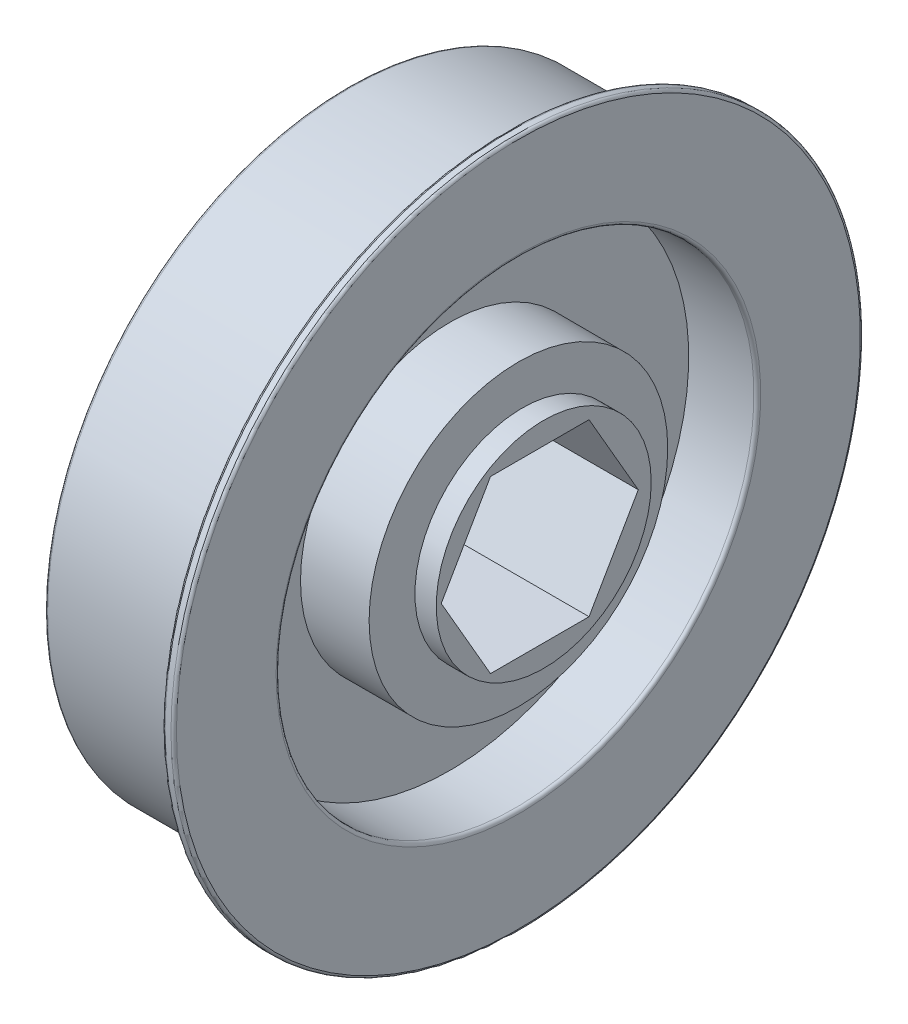
from build123d import *

# Parameters (mm, degrees)
SKETCH2_R          = 11.1125
CUT_EXTRUDE1_DEPTH = 4.7625
CUT_EXTRUDE2_START = -3.175
SKETCH3_R          = 11.1125
CUT_EXTRUDE2_DEPTH = 3.175
CUT_EXTRUDE3_DEPTH = 39.438853223
SKETCH5_R          = 11.1125
SKETCH5_R_2        = 8
CUT_EXTRUDE4_DEPTH = 1.5875


with BuildPart() as part:
    # Sketch1 → Revolve1 (revolve)
    with BuildSketch(Plane(origin=(0, 0, 0), x_dir=(-1, 0, 0), z_dir=(0, 0, -1)), mode=Mode.PRIVATE) as revolve1_sk:
        with BuildLine():
            Line((8.47725, 11.1125), (3.42265, 11.1125))
            Line((3.42265, 11.1125), (3.42265, 17.78))
            Line((3.42265, 17.78), (8.47725, 17.78))
            ThreePointArc((8.47725, 17.78), (8.656855122, 17.854394878), (8.73125, 18.034))
            Line((8.73125, 18.034), (8.73125, 22.3393))
            ThreePointArc((8.73125, 22.3393), (8.671734098, 22.482984098), (8.52805, 22.5425))
            Line((8.52805, 22.5425), (-2.223379112, 22.5425))
            ThreePointArc((-2.223379112, 22.5425), (-2.348046432, 22.585237234), (-2.420273433, 22.695471857))
            Line((-2.420273433, 22.695471857), (-3.135976567, 25.501028143))
            ThreePointArc((-3.135976567, 25.501028143), (-3.208203568, 25.611262766), (-3.332870888, 25.654))
            Line((-3.332870888, 25.654), (-3.76555, 25.654))
            ThreePointArc((-3.76555, 25.654), (-3.909234098, 25.594484098), (-3.96875, 25.4508))
            Line((-3.96875, 25.4508), (-3.96875, 18.034))
            ThreePointArc((-3.96875, 18.034), (-3.894355122, 17.854394878), (-3.71475, 17.78))
            Line((-3.71475, 17.78), (1.13665, 17.78))
            Line((1.13665, 17.78), (1.13665, 11.1125))
            Line((1.13665, 11.1125), (-10.11555, 11.1125))
            ThreePointArc((-10.11555, 11.1125), (-10.259234098, 11.052984098), (-10.31875, 10.9093))
            Line((-10.31875, 10.9093), (-10.31875, 3.3782))
            ThreePointArc((-10.31875, 3.3782), (-10.259234098, 3.234515902), (-10.11555, 3.175))
            Line((-10.11555, 3.175), (10.11555, 3.175))
            ThreePointArc((10.11555, 3.175), (10.259234098, 3.234515902), (10.31875, 3.3782))
            Line((10.31875, 3.3782), (10.31875, 4.5593))
            ThreePointArc((10.31875, 4.5593), (10.259234098, 4.702984098), (10.11555, 4.7625))
            Line((10.11555, 4.7625), (8.73125, 4.7625))
            Line((8.73125, 4.7625), (8.73125, 10.8585))
            ThreePointArc((8.73125, 10.8585), (8.656855122, 11.038105122), (8.47725, 11.1125))
        make_face()
    revolve(revolve1_sk.sketch.rotate(Axis((10.322461745, 0, 0), (-1, 0, 0)), 270), axis=Axis((10.322461745, 0, 0), (-1, 0, 0)))

    # Sketch2 → Cut-Extrude1 (cut)
    with BuildSketch(Plane(origin=(10.31875, 0, 0), x_dir=(0, 0, -1), z_dir=(1, 0, 0))):
        with Locations(Location((0, 0, 0), (0, 0, 180))):
            Circle(SKETCH2_R)
    extrude(amount=-CUT_EXTRUDE1_DEPTH, mode=Mode.SUBTRACT)

    # Sketch3 → Cut-Extrude2 (cut)
    with BuildSketch(Plane.ZY.offset(10.31875).offset(CUT_EXTRUDE2_START)):
        Circle(SKETCH3_R)
    extrude(amount=CUT_EXTRUDE2_DEPTH, mode=Mode.SUBTRACT)

    # Sketch4 → Cut-Extrude3 (cut, through all)
    with BuildSketch(Plane.ZY.offset(7.14375)):
        Polygon((3.666174209, 6.35), (-3.666174209, 6.35), (-7.332348419, 0), (-3.666174209, -6.35), (3.666174209, -6.35), (7.332348419, 0), align=None)
    extrude(amount=-CUT_EXTRUDE3_DEPTH, mode=Mode.SUBTRACT)

    # Sketch5 → Cut-Extrude4 (cut)
    with BuildSketch(Plane(origin=(5.55625, 0, 0), x_dir=(0, 0, -1), z_dir=(1, 0, 0))):
        with Locations(Location((0, 0, 0), (0, 0, 180))):
            Circle(SKETCH5_R)
        with Locations((0.296341565, 0)):
            Circle(SKETCH5_R_2, mode=Mode.SUBTRACT)
    extrude(amount=-CUT_EXTRUDE4_DEPTH, mode=Mode.SUBTRACT)


solid = part.part
